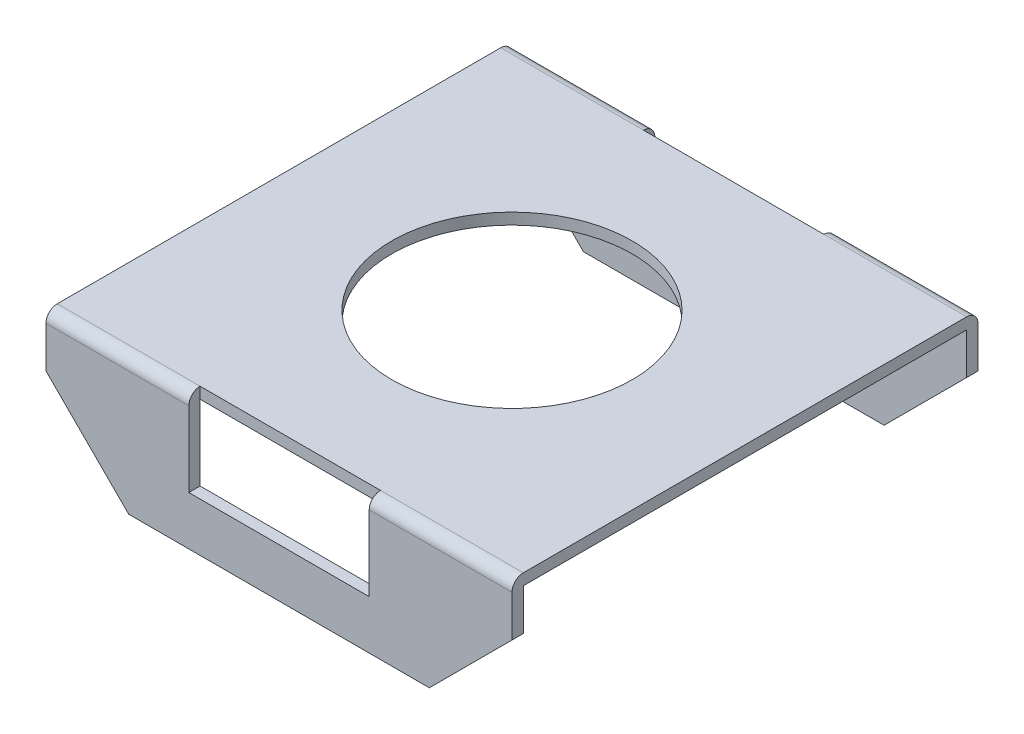
from build123d import *

# Parameters (mm, degrees)
EXTRUDE_THIN3_DEPTH     = 3.1
CUT_EXTRUDE1_DEPTH      = 5.818713521
CUT_EXTRUDE1_DEPTH_BACK = 5.818713521
SKETCH2_W               = 2.4
SKETCH2_H               = 1
SKETCH3_W               = 2.4
SKETCH3_H               = 0.15
CUT_EXTRUDE2_DEPTH      = 1
FILLET1_R               = 0.15
SKETCH4_R               = 1.6
CUT_EXTRUDE3_DEPTH      = 1


with BuildPart() as part:
    # Sketch1 → Extrude-Thin3 (new, symmetric)
    with BuildSketch(Plane(origin=(0, 0, 0), x_dir=(0, 0, -1), z_dir=(1, 0, 0))):
        Polygon((-3.1, 0.2), (-3.1, 2), (3.1, 2), (3.1, 0.2), (2.95, 0.2), (2.95, 1.85), (-2.95, 1.85), (-2.95, 0.2), align=None)
    extrude(amount=EXTRUDE_THIN3_DEPTH, both=True)

    # Sketch2 → Cut-Extrude1 (cut, two sides: drawn at the far end of the back side and taken through both)
    with BuildSketch(Plane.XY.offset(-CUT_EXTRUDE1_DEPTH_BACK)):
        with Locations((0, 1.35)):
            Rectangle(SKETCH2_W, SKETCH2_H)
        Polygon((-3.1, 1.3), (-2, 0.2), (-3.1, 0.2), align=None)
        Polygon((3.1, 0.2), (3.1, 1.3), (2, 0.2), align=None)
    extrude(amount=CUT_EXTRUDE1_DEPTH + CUT_EXTRUDE1_DEPTH_BACK, mode=Mode.SUBTRACT)

    # Sketch3 → Cut-Extrude2 (cut)
    with BuildSketch(Plane(origin=(0, 2, 0), x_dir=(1, 0, 0), z_dir=(0, 1, 0))):
        with Locations((0, 3.025)):
            Rectangle(SKETCH3_W, SKETCH3_H)
        with Locations((0, -3.025)):
            Rectangle(SKETCH3_W, SKETCH3_H)
    extrude(amount=-CUT_EXTRUDE2_DEPTH, mode=Mode.SUBTRACT)

    # Fillet1
    fillet1_edges = [part.edges().sort_by_distance(p)[0] for p in [
        (-2.15, 2, -3.1),
        (2.15, 2, -3.1),
        (-2.15, 2, 3.1),
        (2.15, 2, 3.1),
    ]]
    fillet(fillet1_edges, radius=FILLET1_R)

    # Sketch4 → Cut-Extrude3 (cut)
    with BuildSketch(Plane(origin=(0, 2, 0), x_dir=(1, 0, 0), z_dir=(0, 1, 0))):
        with Locations(Location((0, 0, 0), (0, 0, 270))):
            Circle(SKETCH4_R)
    extrude(amount=-CUT_EXTRUDE3_DEPTH, mode=Mode.SUBTRACT)


solid = part.part
